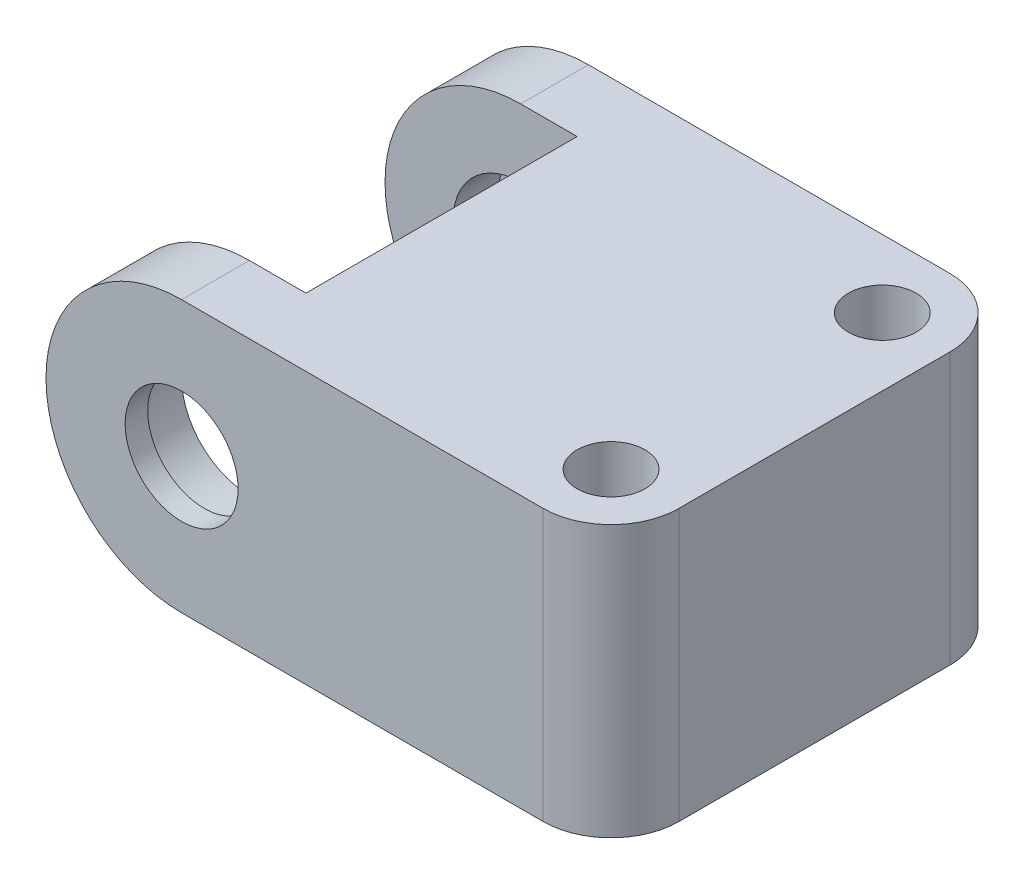
from build123d import *

# Parameters (mm, degrees)
SKETCH1_R               = 6
SKETCH1_R_2             = 2.5
BOSS_EXTRUDE1_DEPTH     = 9
SKETCH2_R               = 1.5
BOSS_EXTRUDE2_DEPTH     = 6
CUT_EXTRUDE2_DEPTH      = 22.863211109
CUT_EXTRUDE2_DEPTH_BACK = 22.863211109
SKETCH5_W               = 8.5
SKETCH5_H               = 12


with BuildPart() as part:
    # Sketch1 → Boss-Extrude1 (new, symmetric)
    with BuildSketch(Plane.XY):
        Circle(SKETCH1_R)
        Circle(SKETCH1_R_2, mode=Mode.SUBTRACT)
    extrude(amount=BOSS_EXTRUDE1_DEPTH, both=True)

    # Sketch2 → Boss-Extrude2 (add, symmetric)
    with BuildSketch(Plane(origin=(0, 0, 0), x_dir=(1, 0, 0), z_dir=(0, 1, 0))):
        with BuildLine():
            Line((0, 9), (16, 9))
            ThreePointArc((16, 9), (18.121320344, 8.121320344), (19, 6))
            Line((19, 6), (19, -6))
            ThreePointArc((19, -6), (18.121320344, -8.121320344), (16, -9))
            Line((16, -9), (0, -9))
            Line((0, -9), (0, 9))
        make_face()
        with Locations((16, 6)):
            Circle(SKETCH2_R, mode=Mode.SUBTRACT)
        with Locations((16, -6)):
            Circle(SKETCH2_R, mode=Mode.SUBTRACT)
    extrude(amount=BOSS_EXTRUDE2_DEPTH, both=True)

    # Sketch3 → Cut-Revolve1 (revolve, cut)
    with BuildSketch(Plane(origin=(0, 0, 0), x_dir=(1, 0, 0), z_dir=(0, 1, 0))):
        Polygon((2.5, 8), (2.5, 9), (0, 9), (0, -9), (2.5, -9), (2.5, -8), (3, -8), (3, -6), (4.5, -6), (4.5, 6), (3, 6), (3, 8), align=None)
    revolve(axis=Axis((0, 0, -12.234149704), (0, 0, 1)), mode=Mode.SUBTRACT)

    # Sketch5 → Cut-Extrude2 (cut, two sides: drawn at the far end of the back side and taken through both)
    with BuildSketch(Plane(origin=(0, 0, 0), x_dir=(1, 0, 0), z_dir=(0, 1, 0)).offset(-CUT_EXTRUDE2_DEPTH_BACK)):
        with Locations((-1.75, 0)):
            Rectangle(SKETCH5_W, SKETCH5_H)
    extrude(amount=CUT_EXTRUDE2_DEPTH + CUT_EXTRUDE2_DEPTH_BACK, mode=Mode.SUBTRACT)


solid = part.part
